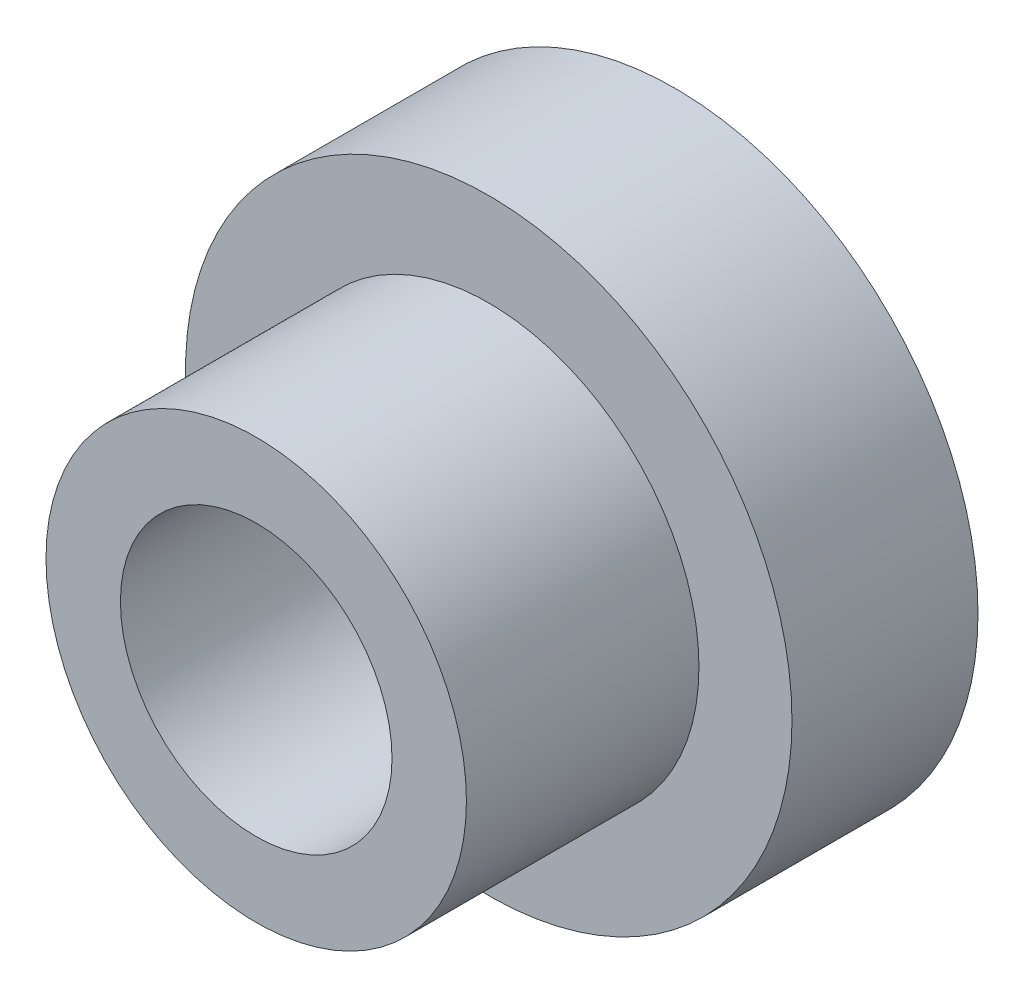
from build123d import *

# Parameters (mm, degrees)
SKETCH1_R           = 11.3
SKETCH1_R_2         = 7.3
BOSS_EXTRUDE1_DEPTH = 17.5
BOSS_EXTRUDE2_START = -5
SKETCH1_4_R         = 16.3
SKETCH1_4_R_2       = 11.3
BOSS_EXTRUDE2_DEPTH = 10


with BuildPart() as part:
    # Sketch1 → Boss-Extrude1 (new body)
    with BuildSketch(Plane.XY):
        Circle(SKETCH1_R)
        Circle(SKETCH1_R_2, mode=Mode.SUBTRACT)
    extrude(amount=BOSS_EXTRUDE1_DEPTH)

    # Sketch1<4> → Boss-Extrude2 (add)
    with BuildSketch(Plane.XY.offset(BOSS_EXTRUDE2_START)):
        Circle(SKETCH1_4_R)
        Circle(SKETCH1_4_R_2, mode=Mode.SUBTRACT)
    extrude(amount=BOSS_EXTRUDE2_DEPTH)


solid = part.part
